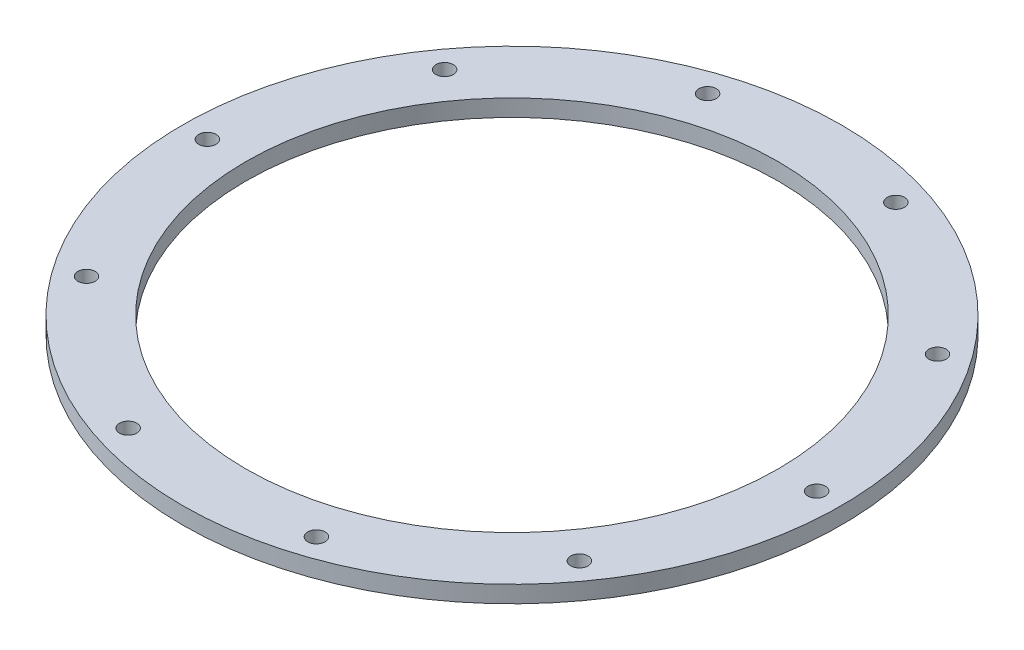
from build123d import *

# Parameters (mm, degrees)
SKETCH_1_R               = 78
SKETCH_1_R_2             = 63
EXTRUDE_1_DEPTH          = 4
SKETCH_2_R               = 2.05
CUT_EXTRUDE_1_DEPTH      = 4
PATTERN_CIRCULAR_1_COUNT = 10


with BuildPart() as part:
    # 草图1 → 凸台-拉伸1 (new body)
    with BuildSketch(Plane(origin=(0, 0, 0), x_dir=(1, 0, 0), z_dir=(0, 1, 0))):
        with Locations(Location((0, 0, 0), (0, 0, 270))):
            Circle(SKETCH_1_R)
        with Locations(Location((0, 0, 0), (0, 0, 270))):
            Circle(SKETCH_1_R_2, mode=Mode.SUBTRACT)
    extrude(amount=EXTRUDE_1_DEPTH)

    # 草图2 → 切除-拉伸1 (cut)
    with BuildSketch(Plane(origin=(0, 4, 0), x_dir=(1, 0, 0), z_dir=(0, 1, 0))):
        with Locations(Location((-72.1, 0, 0), (0, 0, 270))):
            Circle(SKETCH_2_R)
    cut_extrude_1 = extrude(amount=-CUT_EXTRUDE_1_DEPTH, mode=Mode.SUBTRACT)

    # 阵列(圆周)1: 切除-拉伸1 ×10 about axis
    pattern_circular_1_axis = Axis((0, 0, 0), (0, 1, 0))
    for i in range(1, PATTERN_CIRCULAR_1_COUNT):
        add(cut_extrude_1.rotate(pattern_circular_1_axis, i * 360 / PATTERN_CIRCULAR_1_COUNT), mode=Mode.SUBTRACT)


solid = part.part
